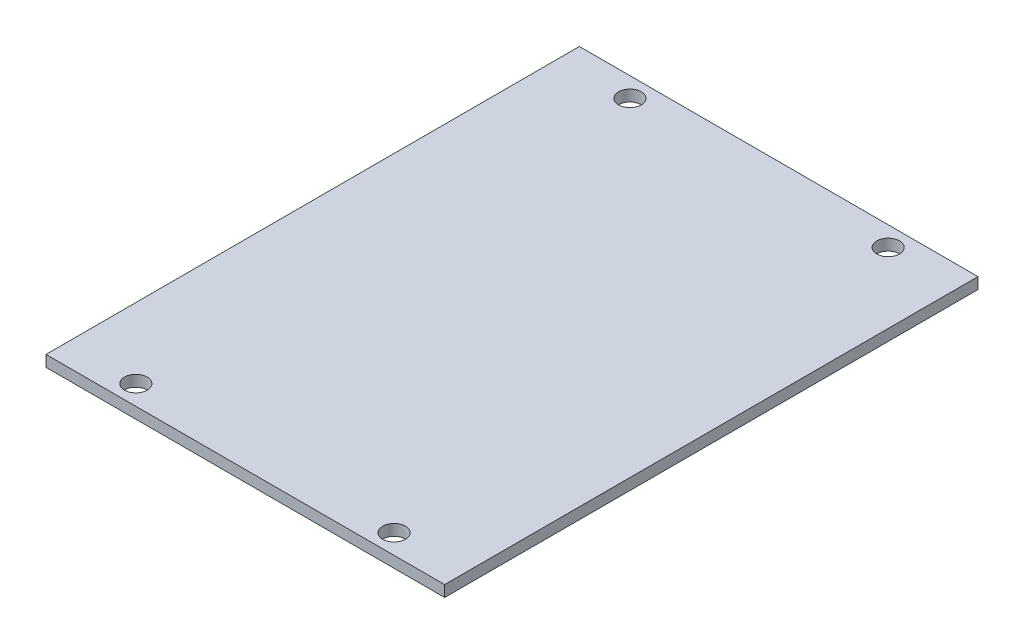
from build123d import *

# Parameters (mm, degrees)
SKETCH1_W           = 71
SKETCH1_H           = 95
BOSS_EXTRUDE1_DEPTH = 2
SKETCH2_R           = 2.025
CUT_EXTRUDE1_DEPTH  = 60.333801496


with BuildPart() as part:
    # Sketch1 → Boss-Extrude1 (new body)
    with BuildSketch(Plane(origin=(0, 0, 0), x_dir=(1, 0, 0), z_dir=(0, 1, 0))):
        Rectangle(SKETCH1_W, SKETCH1_H)
    extrude(amount=BOSS_EXTRUDE1_DEPTH)

    # Sketch2 → Cut-Extrude1 (cut, through all)
    with BuildSketch(Plane(origin=(0, 2, 0), x_dir=(1, 0, 0), z_dir=(0, 1, 0))):
        with Locations(Location((-23, 44, 0), (0, 0, 270))):
            Circle(SKETCH2_R)
        with Locations(Location((23, 44, 0), (0, 0, 90))):
            Circle(SKETCH2_R)
        with Locations(Location((-23, -44, 0), (0, 0, 90))):
            Circle(SKETCH2_R)
        with Locations(Location((23, -44, 0), (0, 0, 270))):
            Circle(SKETCH2_R)
    extrude(amount=-CUT_EXTRUDE1_DEPTH, mode=Mode.SUBTRACT)


solid = part.part
